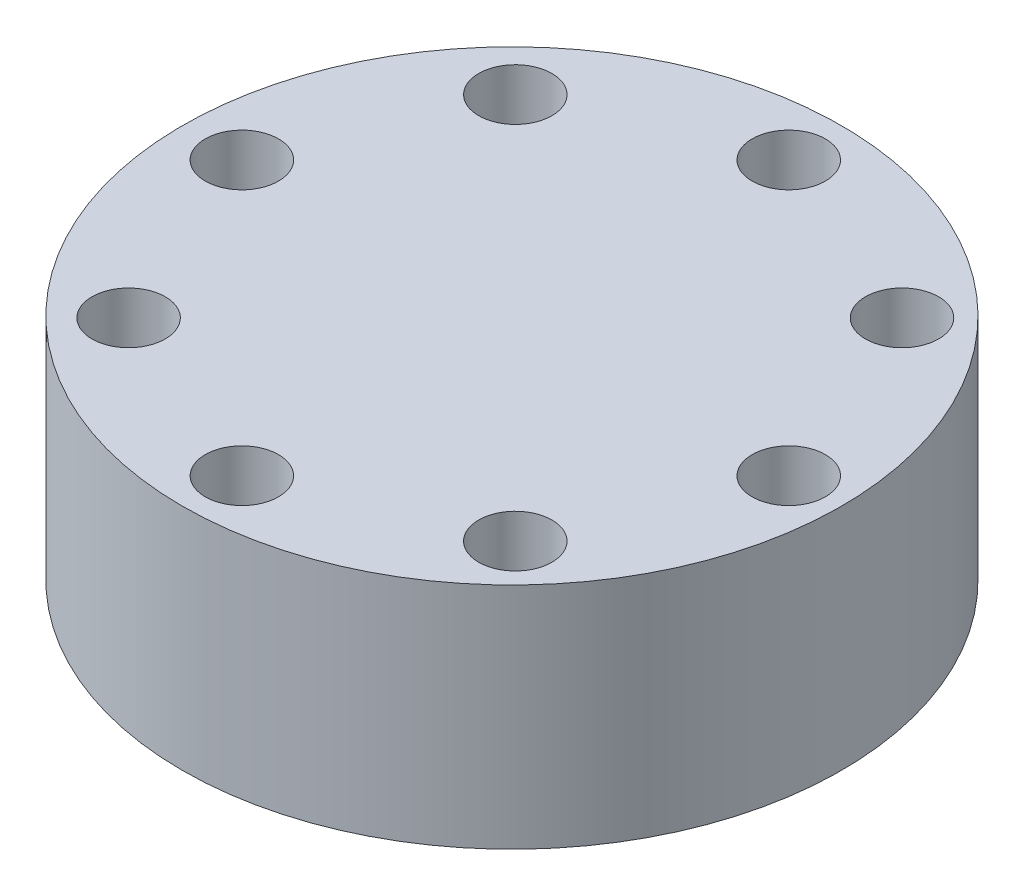
from build123d import *

# Parameters (mm, degrees)
SKETCH1_R           = 36
BOSS_EXTRUDE1_DEPTH = 25
SKETCH3_R           = 4
CUT_EXTRUDE1_DEPTH  = 57.71860365
CIRPATTERN1_COUNT   = 8


with BuildPart() as part:
    # Sketch1 → Boss-Extrude1 (new body)
    with BuildSketch(Plane(origin=(0, 0, 0), x_dir=(1, 0, 0), z_dir=(0, 1, 0))):
        with Locations(Location((0, 0, 0), (0, 0, 270))):
            Circle(SKETCH1_R)
    extrude(amount=BOSS_EXTRUDE1_DEPTH)

    # Sketch3 → Cut-Extrude1 (cut, through all)
    with BuildSketch(Plane(origin=(0, 25, 0), x_dir=(1, 0, 0), z_dir=(0, 1, 0))):
        with Locations(Location((-29.5, 0, 0), (0, 0, 270))):
            Circle(SKETCH3_R)
    cut_extrude1 = extrude(amount=-CUT_EXTRUDE1_DEPTH, mode=Mode.SUBTRACT)

    # CirPattern1: Cut-Extrude1 ×8 about axis
    cirpattern1_axis = Axis((0.36875, 0, 0), (0, 1, 0))
    for i in range(1, CIRPATTERN1_COUNT):
        add(cut_extrude1.rotate(cirpattern1_axis, i * 360 / CIRPATTERN1_COUNT), mode=Mode.SUBTRACT)


solid = part.part
